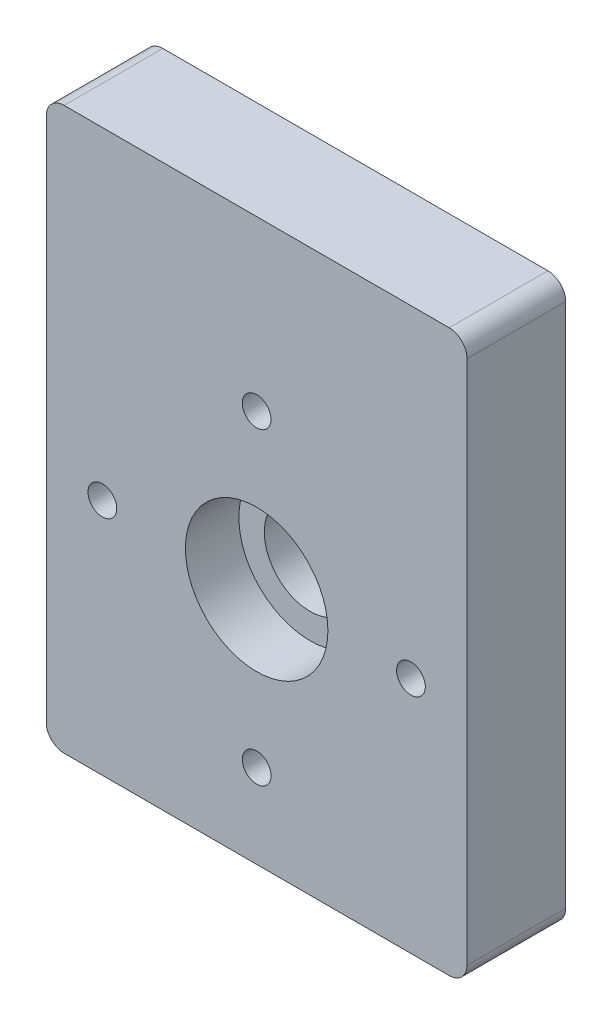
from build123d import *

# Parameters (mm, degrees)
SKETCH1_W                                        = 30
SKETCH1_H                                        = 40
BOSS_EXTRUDE1_DEPTH                              = 7.0358
TAP_DRILL_FOR_M2_5X0_45_TAP1_D                   = 2.05
CBORE_FOR_1_4_SOCKET_HEAD_CAP_SCREW1_D           = 6.5278
CBORE_FOR_1_4_SOCKET_HEAD_CAP_SCREW1_CBORE_D     = 10.16
CBORE_FOR_1_4_SOCKET_HEAD_CAP_SCREW1_CBORE_DEPTH = 3.81
FILLET1_R                                        = 1.27


with BuildPart() as part:
    # Sketch1 → Boss-Extrude1 (new body)
    with BuildSketch(Plane.XY):
        with Locations((15, 20)):
            Rectangle(SKETCH1_W, SKETCH1_H)
    extrude(amount=BOSS_EXTRUDE1_DEPTH)

    # Tap Drill for M2.5x0.45 Tap1 (through all)
    with Locations(Plane.XY.offset(7.0358)):
        with Locations((15, 27.98), (26, 16.98), (15, 5.98), (4, 16.98)):
            Hole(TAP_DRILL_FOR_M2_5X0_45_TAP1_D / 2)

    # CBORE for 1/4 Socket Head Cap Screw1 (through all)
    with Locations(Plane.XY.offset(7.0358)):
        with Locations((15, 16.98)):
            CounterBoreHole(CBORE_FOR_1_4_SOCKET_HEAD_CAP_SCREW1_D / 2, CBORE_FOR_1_4_SOCKET_HEAD_CAP_SCREW1_CBORE_D / 2, CBORE_FOR_1_4_SOCKET_HEAD_CAP_SCREW1_CBORE_DEPTH)

    # Fillet1
    fillet1_edges = [part.edges().sort_by_distance(p)[0] for p in [
        (0, 40, 3.5179),
        (30, 40, 3.5179),
        (30, 0, 3.5179),
        (0, 0, 3.5179),
    ]]
    fillet(fillet1_edges, radius=FILLET1_R)


solid = part.part
